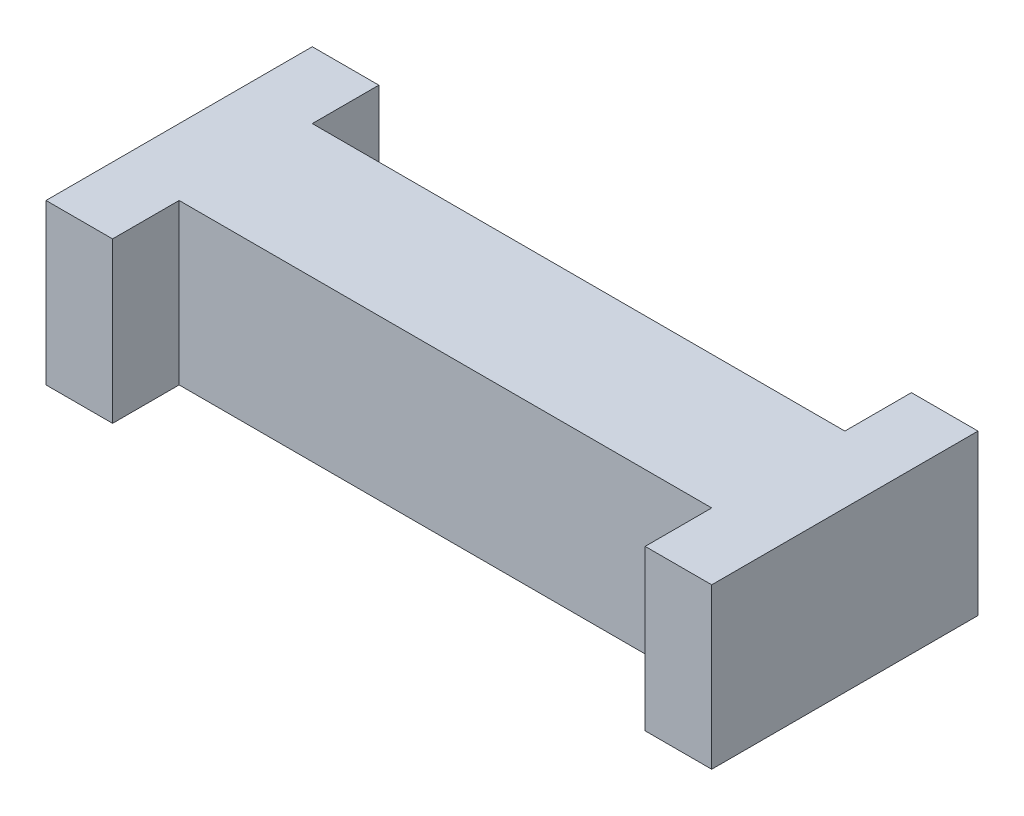
from build123d import *

# Parameters (mm, degrees)
BOSS_EXTRUDE1_DEPTH = 6


with BuildPart() as part:
    # Sketch1 → Boss-Extrude1 (new body)
    with BuildSketch(Plane(origin=(0, 0, 0), x_dir=(1, 0, 0), z_dir=(0, 1, 0))):
        Polygon((-10, 5), (10, 5), (10, 7.5), (12.5, 7.5), (12.5, -2.5), (10, -2.5), (10, 0), (-10, 0), (-10, -2.5), (-12.5, -2.5), (-12.5, 7.5), (-10, 7.5), align=None)
    extrude(amount=BOSS_EXTRUDE1_DEPTH)


solid = part.part
